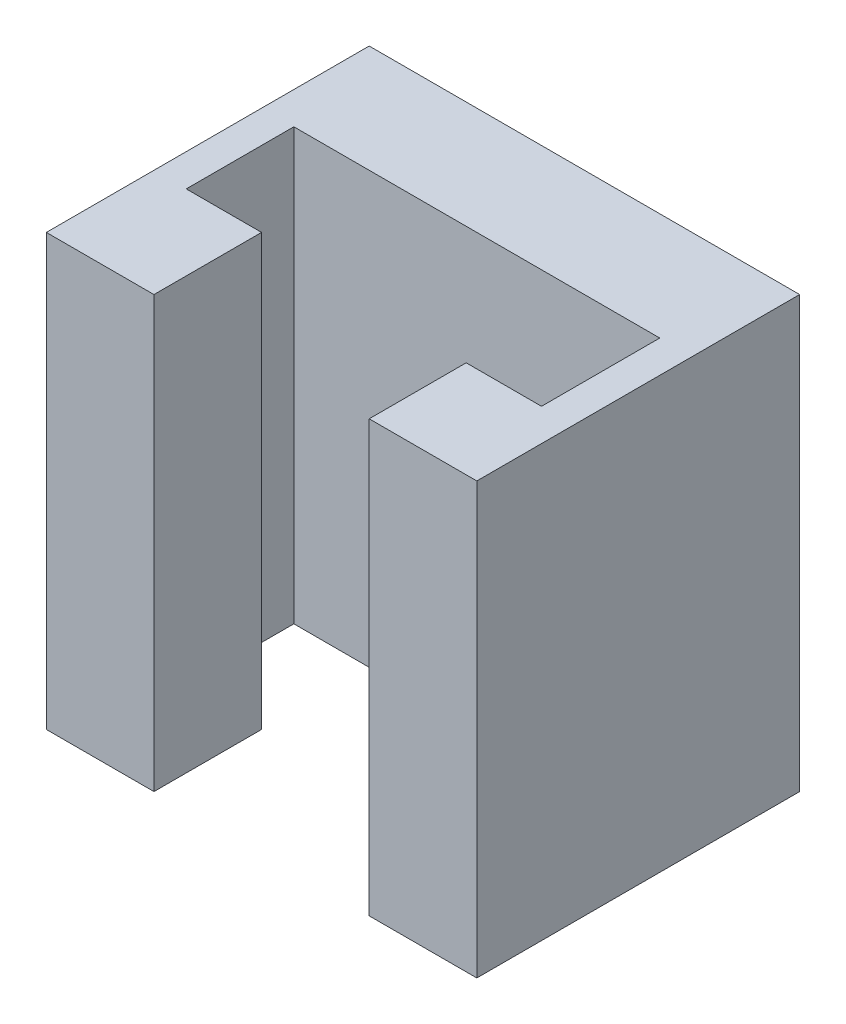
from build123d import *

# Parameters (mm, degrees)
EXTRUDE_1_DEPTH = 20


with BuildPart() as part:
    # 草图4 → 凸台-拉伸1 (new body)
    with BuildSketch(Plane(origin=(0, 0, 0), x_dir=(1, 0, 0), z_dir=(0, 1, 0))):
        Polygon((0, 0), (5, 0), (5, 5), (1.5, 5), (1.5, 10), (18.5, 10), (18.5, 4.50617284), (15, 4.50617284), (15, 0), (20, 0), (20, 15), (0, 15), align=None)
    extrude(amount=EXTRUDE_1_DEPTH)


solid = part.part
